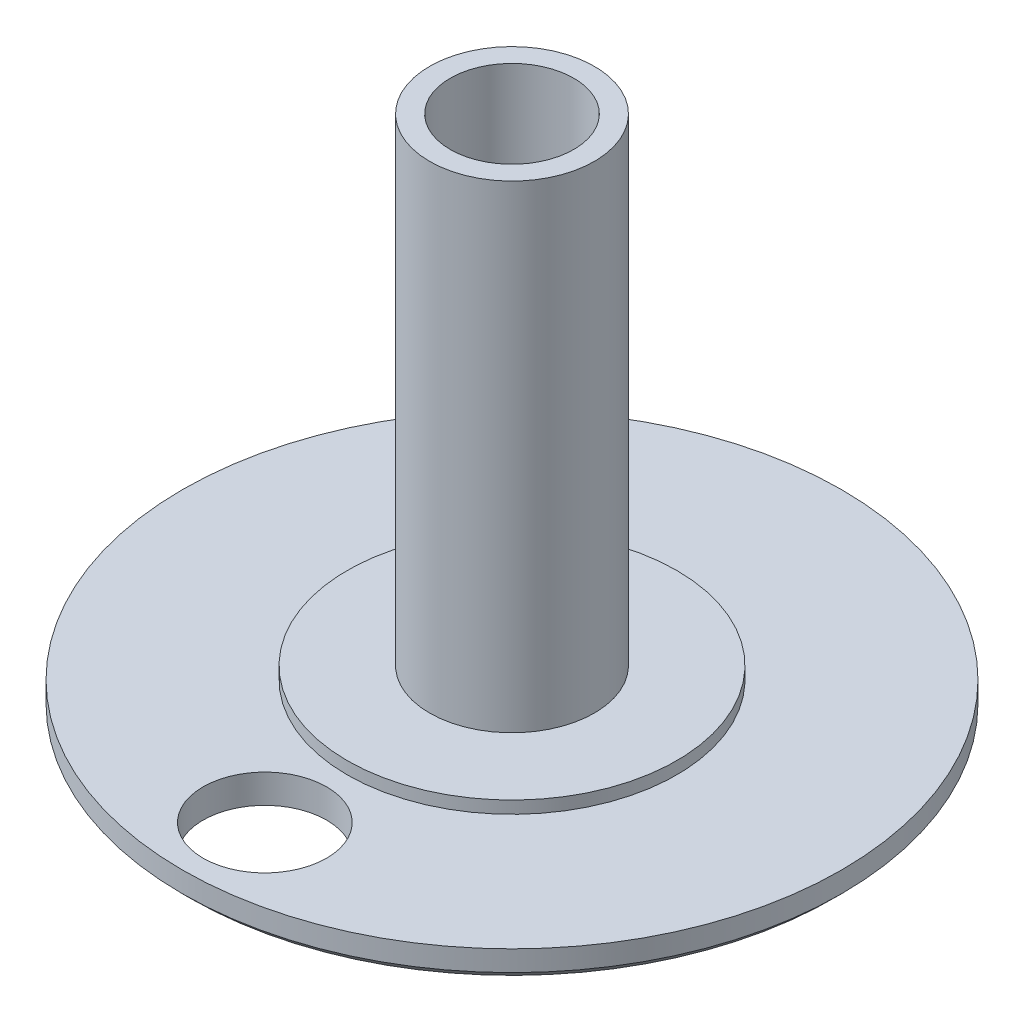
from build123d import *

# Parameters (mm, degrees)
SKETCH1_R           = 8
BOSS_EXTRUDE1_DEPTH = 0.7
SKETCH2_R           = 4
BOSS_EXTRUDE2_DEPTH = 0.3
SKETCH3_R           = 2
BOSS_EXTRUDE3_DEPTH = 11.6
SKETCH4_R           = 1.5
CUT_EXTRUDE1_DEPTH  = 8.5
SKETCH5_R           = 1.5
CUT_EXTRUDE2_DEPTH  = 17.933989489
CHAMFER1_SIZE       = 0.2


with BuildPart() as part:
    # Sketch1 → Boss-Extrude1 (new body)
    with BuildSketch(Plane(origin=(0, 0, 0), x_dir=(1, 0, 0), z_dir=(0, 1, 0))):
        with Locations(Location((0, 0, 0), (0, 0, 270))):
            Circle(SKETCH1_R)
    extrude(amount=BOSS_EXTRUDE1_DEPTH)

    # Sketch2 → Boss-Extrude2 (add)
    with BuildSketch(Plane(origin=(0, 0.7, 0), x_dir=(1, 0, 0), z_dir=(0, 1, 0))):
        with Locations(Location((0, 0, 0), (0, 0, 270))):
            Circle(SKETCH2_R)
    extrude(amount=BOSS_EXTRUDE2_DEPTH)

    # Sketch3 → Boss-Extrude3 (add)
    with BuildSketch(Plane(origin=(0, 1, 0), x_dir=(1, 0, 0), z_dir=(0, 1, 0))):
        with Locations(Location((0, 0, 0), (0, 0, 270))):
            Circle(SKETCH3_R)
    extrude(amount=BOSS_EXTRUDE3_DEPTH)

    # Sketch4 → Cut-Extrude1 (cut)
    with BuildSketch(Plane(origin=(0, 12.6, 0), x_dir=(1, 0, 0), z_dir=(0, 1, 0))):
        with Locations(Location((0, 0, 0), (0, 0, 270))):
            Circle(SKETCH4_R)
    extrude(amount=-CUT_EXTRUDE1_DEPTH, mode=Mode.SUBTRACT)

    # Sketch5 → Cut-Extrude2 (cut, through all)
    with BuildSketch(Plane.XZ):
        with Locations(Location((0, 6, 0), (0, 0, 270))):
            Circle(SKETCH5_R)
    extrude(amount=-CUT_EXTRUDE2_DEPTH, mode=Mode.SUBTRACT)

    # Chamfer1
    chamfer1_edges = [part.edges().sort_by_distance(p)[0] for p in [
        (0, 0, -8),
    ]]
    chamfer(chamfer1_edges, length=CHAMFER1_SIZE)


solid = part.part
